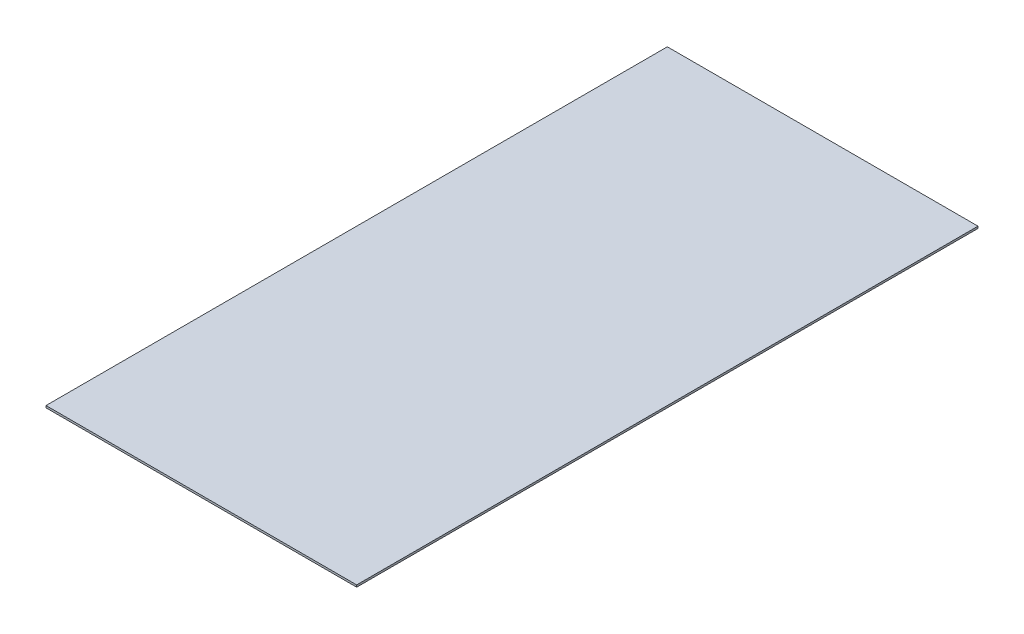
from build123d import *

# Parameters (mm, degrees)
CROQUIS1_W              = 1219.2
CROQUIS1_H              = 2438.4
SALIENTE_EXTRUIR1_DEPTH = 7.9


with BuildPart() as part:
    # Croquis1 → Saliente-Extruir1 (new body)
    with BuildSketch(Plane(origin=(0, 0, 0), x_dir=(1, 0, 0), z_dir=(0, 1, 0))):
        Rectangle(CROQUIS1_W, CROQUIS1_H)
    extrude(amount=SALIENTE_EXTRUIR1_DEPTH)


solid = part.part
